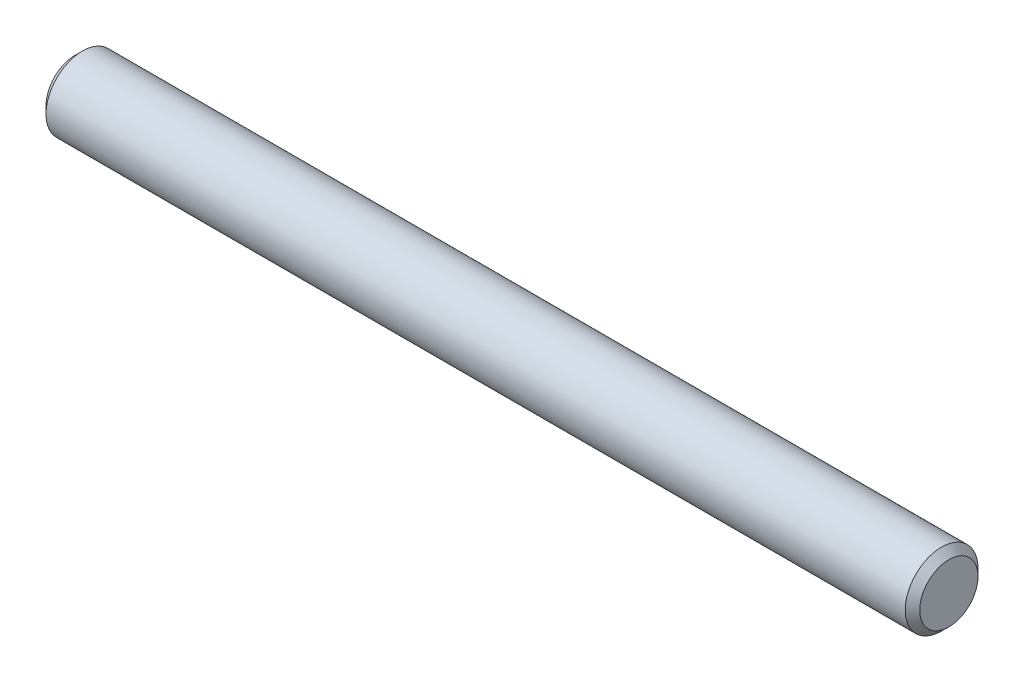
from build123d import *

# Parameters (mm, degrees)
EXTRUDE1_DEPTH      = 19.05
EXTRUDE1_DEPTH_BACK = 19.05
SKETCH2_R           = 1.5875
CHAMFER1_SIZE       = 0.3175


with BuildPart() as part:
    # Sketch2 → Extrude1 (new, two sides: drawn at the far end of the back side and taken through both)
    with BuildSketch(Plane(origin=(0, 0, 0), x_dir=(0, 0, -1), z_dir=(1, 0, 0)).offset(-EXTRUDE1_DEPTH_BACK)):
        Circle(SKETCH2_R)
    extrude(amount=EXTRUDE1_DEPTH + EXTRUDE1_DEPTH_BACK)

    # Chamfer1
    chamfer1_edges = [part.edges().sort_by_distance(p)[0] for p in [
        (-19.05, 0, 1.5875),
        (19.05, 0, 1.5875),
    ]]
    chamfer(chamfer1_edges, length=CHAMFER1_SIZE)


solid = part.part
